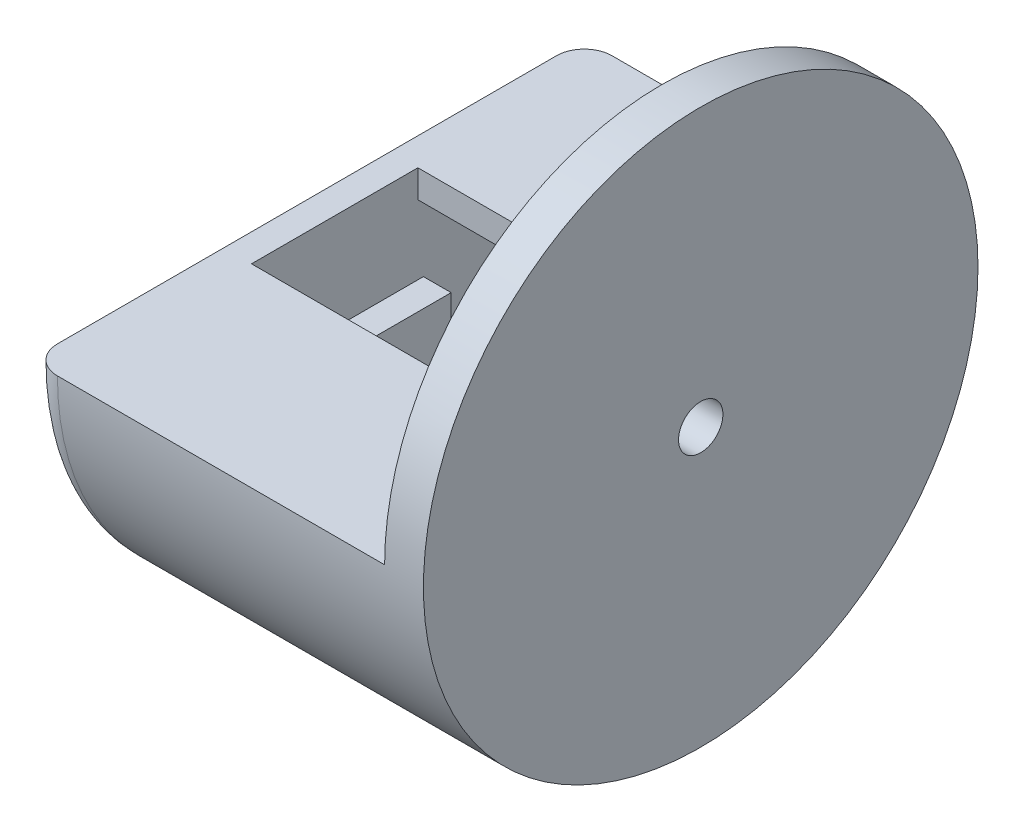
from build123d import *

# Parameters (mm, degrees)
SKETCH1_W           = 50
SKETCH1_H           = 20
BOSS_EXTRUDE1_DEPTH = 10
SKETCH3_W           = 5
SKETCH3_H           = 20
BOSS_EXTRUDE2_DEPTH = 26
SKETCH4_W           = 15
SKETCH4_H           = 36
BOSS_EXTRUDE3_DEPTH = 20
BOSS_EXTRUDE4_DEPTH = 7
BOSS_EXTRUDE5_START = -7
SKETCH6_R           = 50
SKETCH6_R_2         = 4
BOSS_EXTRUDE5_DEPTH = 7
BOSS_EXTRUDE6_START = 64
BOSS_EXTRUDE6_DEPTH = 64
BOSS_EXTRUDE7_DEPTH = 5
FILLET1_R           = 5
SKETCH9_W           = 59
SKETCH9_H           = 30
BOSS_EXTRUDE8_DEPTH = 5


with BuildPart() as part:
    # Sketch1 → Boss-Extrude1 (new body)
    with BuildSketch(Plane(origin=(0, 0, 0), x_dir=(1, 0, 0), z_dir=(0, 1, 0))):
        with Locations((25, 10)):
            Rectangle(SKETCH1_W, SKETCH1_H)
    extrude(amount=BOSS_EXTRUDE1_DEPTH)

    # Sketch3 → Boss-Extrude2 (add)
    with BuildSketch(Plane(origin=(0, 10, 0), x_dir=(1, 0, 0), z_dir=(0, 1, 0))):
        with Locations((2.5, 10)):
            Rectangle(SKETCH3_W, SKETCH3_H)
        with Locations((47.5, 10)):
            Rectangle(SKETCH3_W, SKETCH3_H)
    extrude(amount=BOSS_EXTRUDE2_DEPTH)

    # Sketch4 → Boss-Extrude3 (add)
    with BuildSketch(Plane(origin=(0, 0, -20), x_dir=(-1, 0, 0), z_dir=(0, 0, -1))):
        with Locations((-52.5, 18)):
            Rectangle(SKETCH4_W, SKETCH4_H)
    extrude(amount=-BOSS_EXTRUDE3_DEPTH)

    # Sketch5 → Boss-Extrude4 (add)
    with BuildSketch(Plane(origin=(60, 0, 0), x_dir=(0, 0, -1), z_dir=(1, 0, 0))):
        with BuildLine():
            Line((10, 37.5), (10, 36))
            Line((10, 36), (20, 36))
            Line((20, 36), (20, 47.5))
            ThreePointArc((20, 47.5), (17.071067812, 40.428932188), (10, 37.5))
        make_face()
        with BuildLine():
            ThreePointArc((0, 47.5), (2.928932188, 40.428932188), (10, 37.5))
            Line((10, 37.5), (10, 43.5))
            ThreePointArc((10, 43.5), (7.171572875, 44.671572875), (6, 47.5))
            Line((6, 47.5), (0, 47.5))
        make_face()
        with BuildLine():
            Line((10, 43.5), (10, 37.5))
            ThreePointArc((10, 37.5), (17.071067812, 40.428932188), (20, 47.5))
            Line((20, 47.5), (14, 47.5))
            ThreePointArc((14, 47.5), (12.828427125, 44.671572875), (10, 43.5))
        make_face()
        with BuildLine():
            Line((0, 36), (10, 36))
            Line((10, 36), (10, 37.5))
            ThreePointArc((10, 37.5), (2.928932188, 40.428932188), (0, 47.5))
            Line((0, 47.5), (0, 36))
        make_face()
        with BuildLine():
            ThreePointArc((20, 47.5), (10, 57.5), (0, 47.5))
            Line((0, 47.5), (6, 47.5))
            ThreePointArc((6, 47.5), (10, 51.5), (14, 47.5))
            Line((14, 47.5), (20, 47.5))
        make_face()
    extrude(amount=-BOSS_EXTRUDE4_DEPTH)

    # Sketch6 → Boss-Extrude5 (add)
    with BuildSketch(Plane(origin=(60, 0, 0), x_dir=(0, 0, -1), z_dir=(1, 0, 0)).offset(BOSS_EXTRUDE5_START)):
        with Locations((10, 47.5)):
            Circle(SKETCH6_R)
        with Locations((10, 47.5)):
            Circle(SKETCH6_R_2, mode=Mode.SUBTRACT)
    extrude(amount=BOSS_EXTRUDE5_DEPTH)

    # Sketch7 → Boss-Extrude6 (add)
    with BuildSketch(Plane.ZY.offset(-53).offset(BOSS_EXTRUDE6_START)):
        with BuildLine():
            Line((-60, 47.5), (-55, 47.5))
            ThreePointArc((-55, 47.5), (-10, 2.5), (35, 47.5))
            Line((35, 47.5), (40, 47.5))
            ThreePointArc((40, 47.5), (-10, -2.5), (-60, 47.5))
        make_face()
    extrude(amount=-BOSS_EXTRUDE6_DEPTH)

    # Sketch8 → Boss-Extrude7 (add)
    with BuildSketch(Plane.ZY.offset(11)):
        with BuildLine():
            Line((-55, 47.5), (35, 47.5))
            ThreePointArc((35, 47.5), (-10, 2.5), (-55, 47.5))
        make_face()
    extrude(amount=-BOSS_EXTRUDE7_DEPTH)

    # Fillet1
    fillet1_edges = [part.edges().sort_by_distance(p)[0] for p in [
        (-11, -2.5, -10),
    ]]
    fillet(fillet1_edges, radius=FILLET1_R)

    # Sketch9 → Boss-Extrude8 (add)
    with BuildSketch(Plane(origin=(0, 47.5, 0), x_dir=(1, 0, 0), z_dir=(0, 1, 0))):
        with Locations((23.5, 40)):
            Rectangle(SKETCH9_W, SKETCH9_H)
        with Locations((23.5, -20)):
            Rectangle(SKETCH9_W, SKETCH9_H)
    extrude(amount=-BOSS_EXTRUDE8_DEPTH)


solid = part.part
